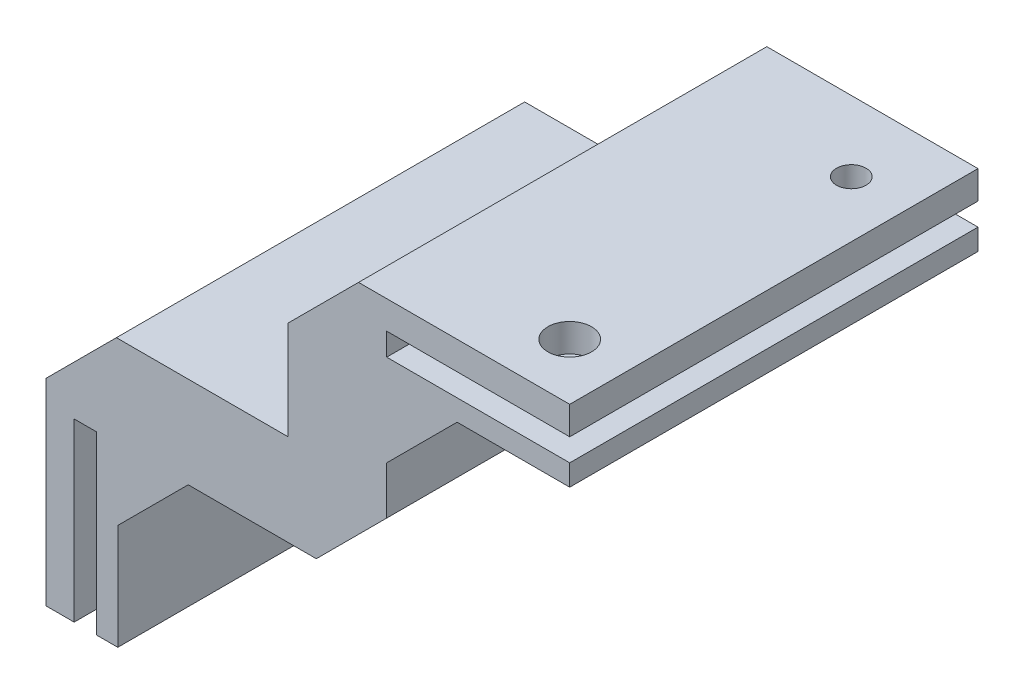
from build123d import *

# Parameters (mm, degrees)
DODANIE_WYCI_GNI_CIE1_DEPTH     = 58
SFAZOWANIE1_SIZE                = 10
SZKIC2_W                        = 4
SZKIC2_H                        = 58
SZKIC2_W_2                      = 3
DODANIE_WYCI_GNI_CIE2_DEPTH     = 10
SZKIC3_R                        = 2.1
SZKIC3_R_2                      = 3.1
WYTNIJ_WYCI_GNI_CIE1_DEPTH      = 108.622488356
SZKIC4_R                        = 2.1
WYTNIJ_WYCI_GNI_CIE2_DEPTH      = 101.943746711
WYTNIJ_WYCI_GNI_CIE3_DEPTH      = 168.894848045
WYTNIJ_WYCI_GNI_CIE3_DEPTH_BACK = 168.894848045
SZKIC5_W                        = 90.111418636
SZKIC5_H                        = 70.976902515


with BuildPart() as part:
    # Szkic1 → Dodanie-wyciągnięcie1 (new body)
    with BuildSketch(Plane.XY):
        Polygon((0, 0), (-4, 0), (-4, 15), (-7.2, 15), (-7.2, 0), (-10.2, 0), (-10.2, 15), (-38.4, 15), (-48.4, 25), (-48.4, 41.8), (-74.4, 41.8), (-74.4, 44.8), (-48.4, 44.8), (-48.4, 48), (-74.4, 48), (-74.4, 52), (-34.4, 52), (-34.4, 28), (0, 28), align=None)
    extrude(amount=DODANIE_WYCI_GNI_CIE1_DEPTH)

    # Sfazowanie1
    sfazowanie1_edges = [part.edges().sort_by_distance(p)[0] for p in [
        (-10.2, 15, 29),
        (-48.4, 41.8, 29),
        (-34.4, 52, 29),
        (0, 28, 29),
    ]]
    chamfer(sfazowanie1_edges, length=SFAZOWANIE1_SIZE)

    # Szkic2 → Dodanie-wyciągnięcie2 (add)
    with BuildSketch(Plane.XZ):
        with Locations((-2, 29)):
            Rectangle(SZKIC2_W, SZKIC2_H)
        with Locations((-8.7, 29)):
            Rectangle(SZKIC2_W_2, SZKIC2_H)
    extrude(amount=DODANIE_WYCI_GNI_CIE2_DEPTH)

    # Szkic3 → Wytnij-wyciągnięcie1 (cut, through all)
    with BuildSketch(Plane.XZ.offset(-41.8)):
        with Locations((-66.4, 10)):
            Circle(SZKIC3_R)
        with Locations((-66.4, 50)):
            Circle(SZKIC3_R_2)
    extrude(amount=-WYTNIJ_WYCI_GNI_CIE1_DEPTH, mode=Mode.SUBTRACT)

    # Szkic4 → Wytnij-wyciągnięcie2 (cut, through all)
    with BuildSketch(Plane.ZY.offset(10.2)):
        with Locations((14, -3)):
            Circle(SZKIC4_R)
    extrude(amount=-WYTNIJ_WYCI_GNI_CIE2_DEPTH, mode=Mode.SUBTRACT)


with BuildPart() as body_2:
    # Lustro1: mirrored copy
    add(part.part.mirror(Plane(origin=(-74.4, 52, 58), x_dir=(0, 0, 1), z_dir=(1, 0, 0))))


with BuildPart() as part_1:
    add(part.part)

    # Szkic5 → Wytnij-wyciągnięcie3 (cut, two sides: drawn at the far end of the back side and taken through both)
    with BuildSketch(Plane.XZ.offset(-41.8).offset(-WYTNIJ_WYCI_GNI_CIE3_DEPTH_BACK)):
        with Locations((-29.344290682, 35.488451258)):
            Rectangle(SZKIC5_W, SZKIC5_H)
    extrude(amount=WYTNIJ_WYCI_GNI_CIE3_DEPTH + WYTNIJ_WYCI_GNI_CIE3_DEPTH_BACK, mode=Mode.SUBTRACT)


solid = body_2.part
